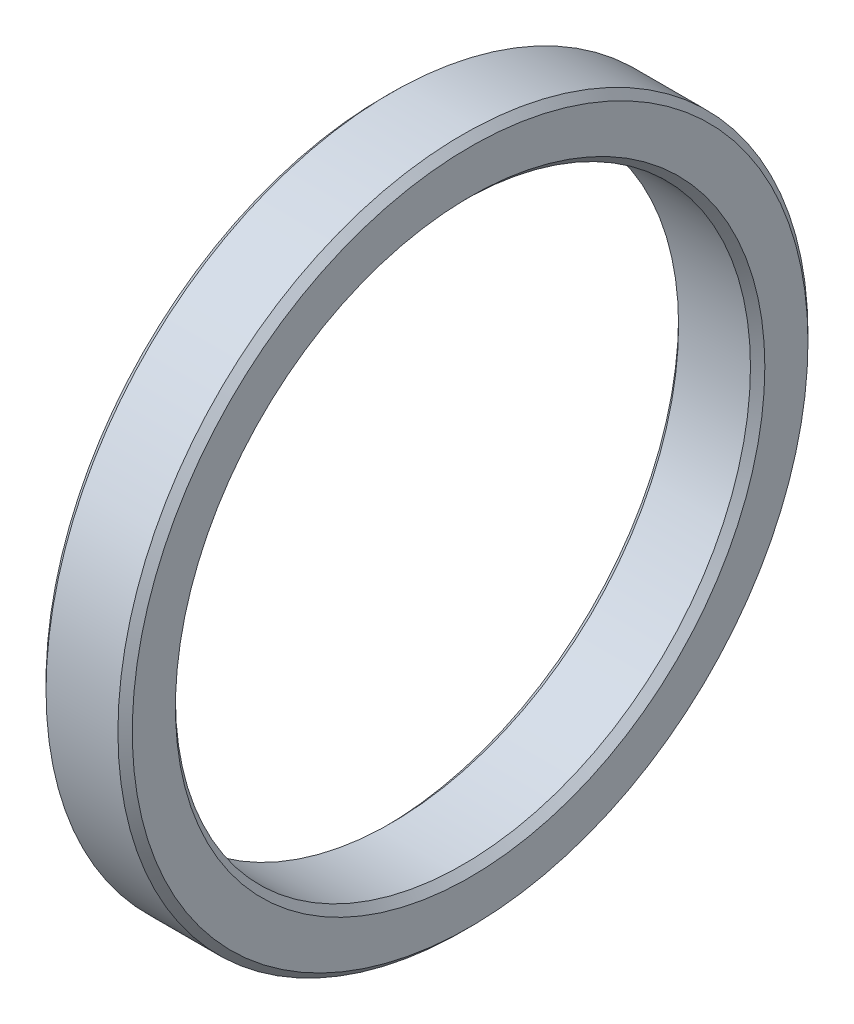
from build123d import *

# Parameters (mm, degrees)
SKETCH_1_R      = 24
SKETCH_1_R_2    = 20
EXTRUDE_1_DEPTH = 6
CHAMFER_1_SIZE  = 0.5


with BuildPart() as part:
    # 草图1 → 凸台-拉伸1 (new body)
    with BuildSketch(Plane(origin=(0, 0, 0), x_dir=(0, 0, -1), z_dir=(1, 0, 0))):
        Circle(SKETCH_1_R)
        Circle(SKETCH_1_R_2, mode=Mode.SUBTRACT)
    extrude(amount=EXTRUDE_1_DEPTH)

    # 倒角1
    chamfer_1_edges = [part.edges().sort_by_distance(p)[0] for p in [
        (0, 0, 24),
        (6, 0, 24),
        (0, 0, 20),
        (6, 0, 20),
    ]]
    chamfer(chamfer_1_edges, length=CHAMFER_1_SIZE)


solid = part.part
